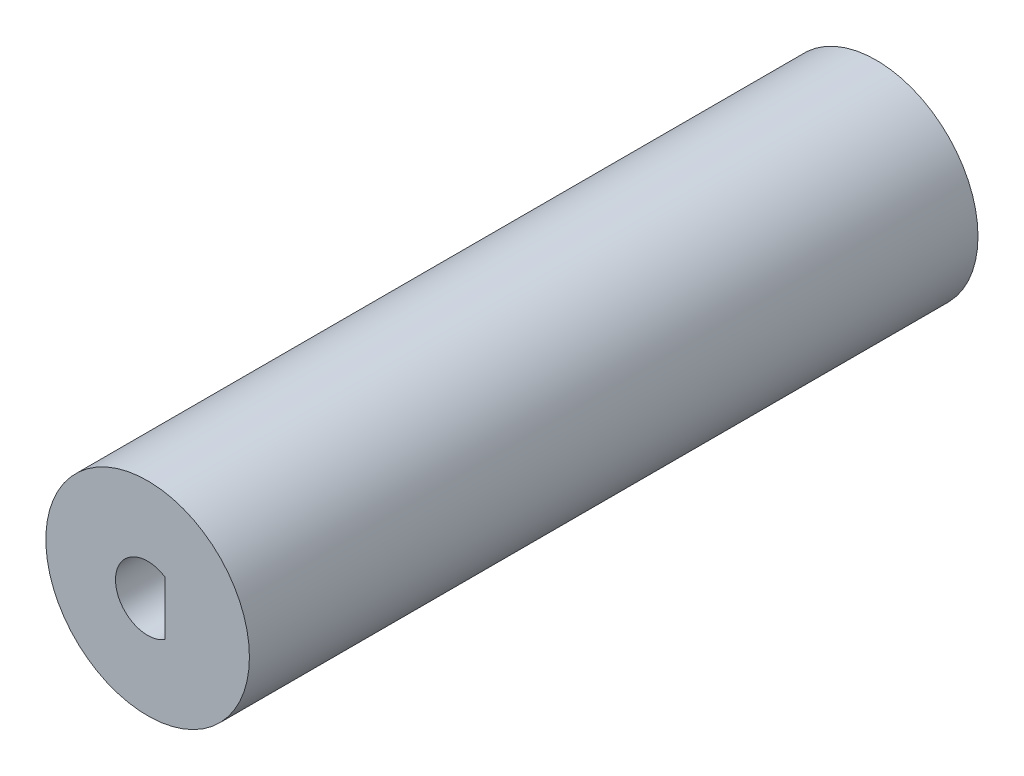
from build123d import *

# Parameters (mm, degrees)
EXTRUDE_1_DEPTH      = 0.5
EXTRUDE_1_DEPTH_BACK = 33.5
SKETCH_1_R           = 4.75
SKETCH_2_R           = 1.5
CUT_EXTRUDE_1_DEPTH  = 10
CUT_EXTRUDE_START    = -8
CUT_EXTRUDE_2_DEPTH  = 8


with BuildPart() as part:
    # 草图1 → 凸台-拉伸1 (new, two sides: drawn at the far end of the back side and taken through both)
    with BuildSketch(Plane.XY.offset(-EXTRUDE_1_DEPTH_BACK)):
        Circle(SKETCH_1_R)
    extrude(amount=EXTRUDE_1_DEPTH + EXTRUDE_1_DEPTH_BACK)

    # 草图2 → 切除-拉伸1 (cut)
    with BuildSketch(Plane(origin=(0, 0, -33.5), x_dir=(-1, 0, 0), z_dir=(0, 0, -1))):
        Circle(SKETCH_2_R)
    extrude(amount=-CUT_EXTRUDE_1_DEPTH, mode=Mode.SUBTRACT)

    # 草图3 → 切除-拉伸2 (cut)
    with BuildSketch(Plane.XY.offset(0.5).offset(CUT_EXTRUDE_START)):
        with BuildLine():
            Line((0.8, 1.268857754), (0.8, -1.268857754))
            ThreePointArc((0.8, -1.268857754), (-1.5, 0), (0.8, 1.268857754))
        make_face()
    extrude(amount=CUT_EXTRUDE_2_DEPTH, mode=Mode.SUBTRACT)


solid = part.part
